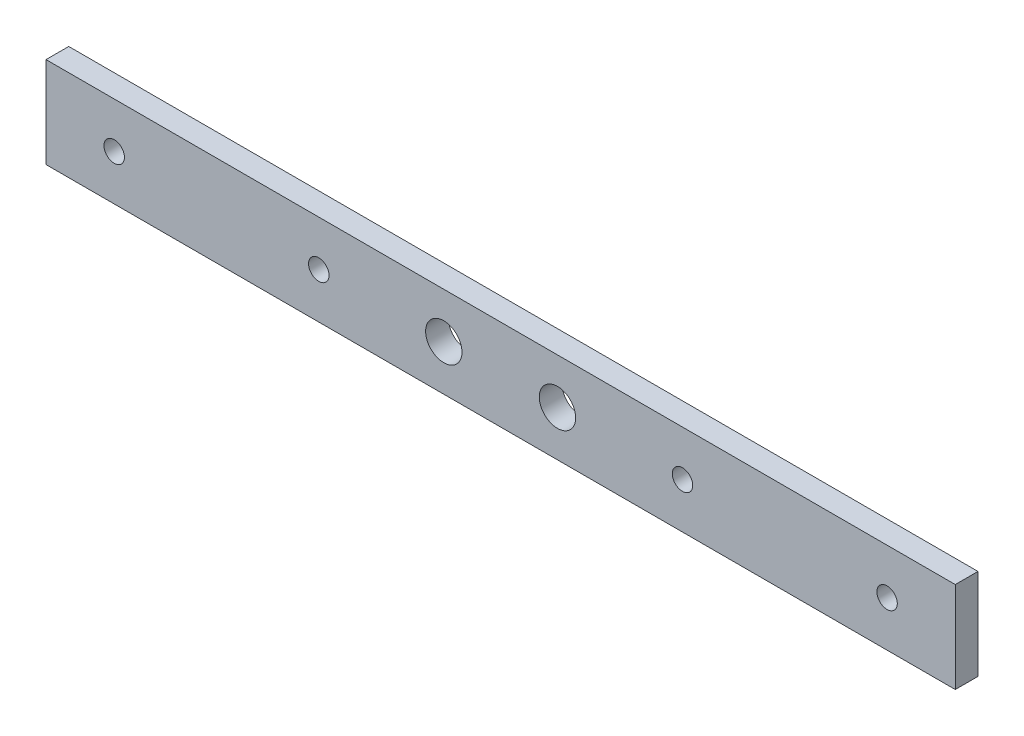
from build123d import *

# Parameters (mm, degrees)
ESQUISSE1_W        = 200
ESQUISSE1_H        = 20
ESQUISSE1_R        = 2.25
ESQUISSE1_R_2      = 4
BOSS_EXTRU_1_DEPTH = 5


with BuildPart() as part:
    # Esquisse1 → Boss.-Extru.1 (new body)
    with BuildSketch(Plane.XY):
        Rectangle(ESQUISSE1_W, ESQUISSE1_H)
        with Locations((-85, 0)):
            Circle(ESQUISSE1_R, mode=Mode.SUBTRACT)
        with Locations((-40, 0)):
            Circle(ESQUISSE1_R, mode=Mode.SUBTRACT)
        with Locations(Location((40, 0, 0), (0, 0, 180))):
            Circle(ESQUISSE1_R, mode=Mode.SUBTRACT)
        with Locations(Location((85, 0, 0), (0, 0, 180))):
            Circle(ESQUISSE1_R, mode=Mode.SUBTRACT)
        with Locations((-12.5, 0)):
            Circle(ESQUISSE1_R_2, mode=Mode.SUBTRACT)
        with Locations(Location((12.5, 0, 0), (0, 0, 180))):
            Circle(ESQUISSE1_R_2, mode=Mode.SUBTRACT)
    extrude(amount=BOSS_EXTRU_1_DEPTH)


solid = part.part
